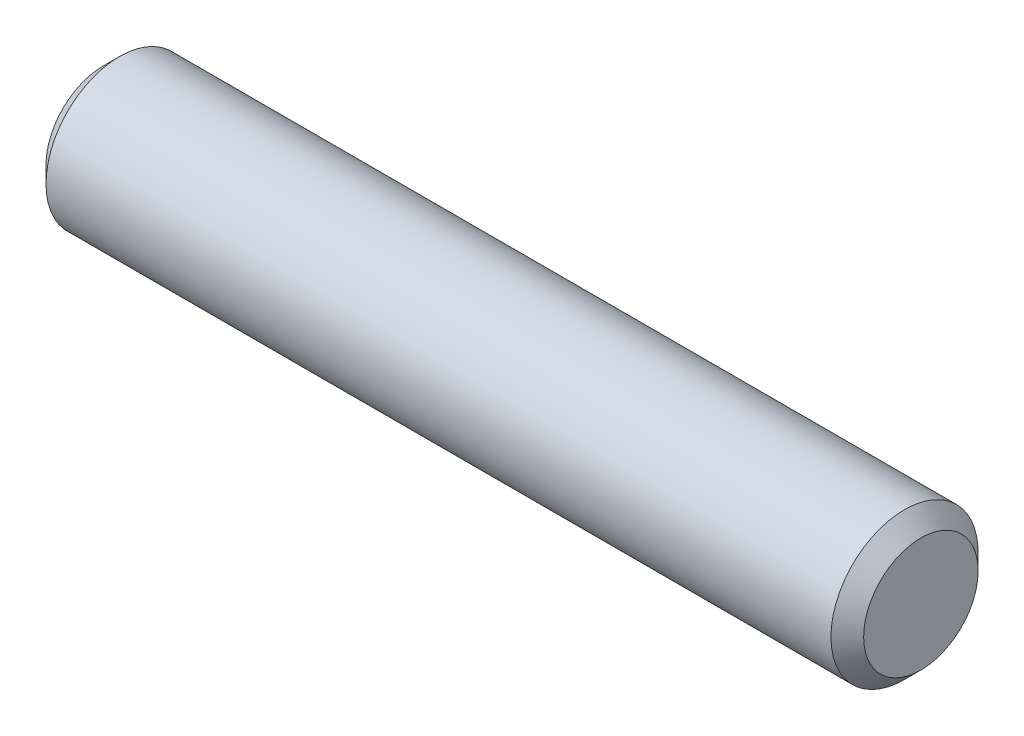
from build123d import *

# Parameters (mm, degrees)
SKETCH_1_W     = 10
SKETCH_1_H     = 0.9
CHAMFER_1_SIZE = 0.2


with BuildPart() as part:
    # 草图1 → 旋转1 (revolve)
    with BuildSketch(Plane.XY, mode=Mode.PRIVATE) as revolve_1_sk:
        with Locations((-0.342696629, 0.45)):
            Rectangle(SKETCH_1_W, SKETCH_1_H)
    revolve(revolve_1_sk.sketch.rotate(Axis((-6.320224719, 0, 0), (1, 0, 0)), 90), axis=Axis((-6.320224719, 0, 0), (1, 0, 0)))

    # 倒角1
    chamfer_1_edges = [part.edges().sort_by_distance(p)[0] for p in [
        (4.657303371, 0, -0.9),
        (-5.342696629, 0, -0.9),
    ]]
    chamfer(chamfer_1_edges, length=CHAMFER_1_SIZE)


solid = part.part
